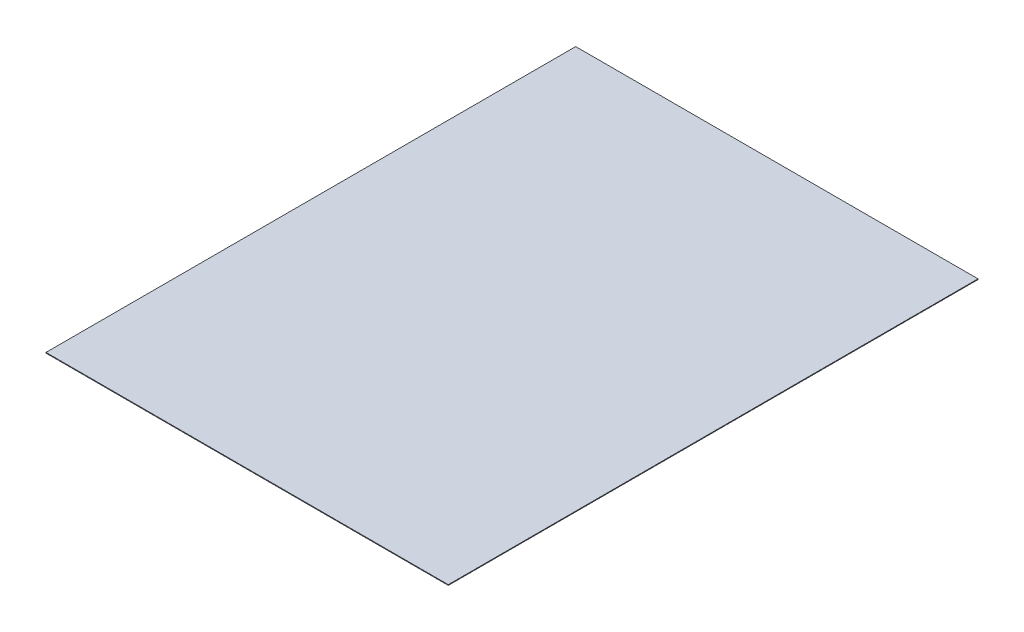
from build123d import *

# Parameters (mm, degrees)
ESQUISSE1_W        = 6000
ESQUISSE1_H        = 7900
BOSS_EXTRU_1_DEPTH = 10


with BuildPart() as part:
    # Esquisse1 → Boss.-Extru.1 (new body)
    with BuildSketch(Plane(origin=(0, 0, 0), x_dir=(1, 0, 0), z_dir=(0, 1, 0))):
        Rectangle(ESQUISSE1_W, ESQUISSE1_H)
    extrude(amount=BOSS_EXTRU_1_DEPTH)


solid = part.part
